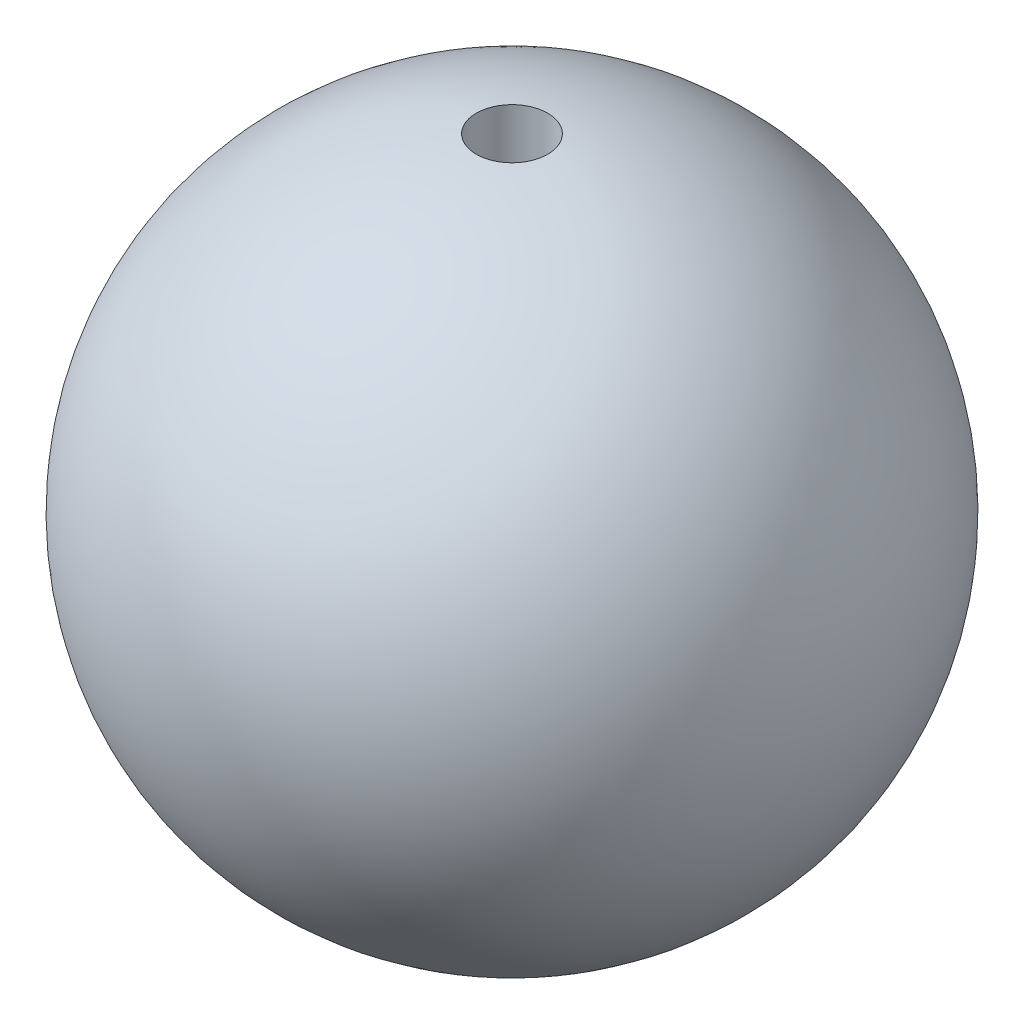
from build123d import *


with BuildPart() as part:
    # 草图1 → 旋转1 (revolve)
    with BuildSketch(Plane.XY):
        with BuildLine():
            Line((-100, 918.572806042), (-100, 149.666295471))
            ThreePointArc((-100, 149.666295471), (-170.984980078, 56.250658554), (-169.325890431, -61.063432836))
            ThreePointArc((-169.325890431, -61.063432836), (-194.123598841, -215.625132445), (-100, -340.705080757))
            Line((-100, -340.705080757), (-100, -918.572806042))
            ThreePointArc((-100, -918.572806042), (-924, 0), (-100, 918.572806042))
        make_face()
    revolve(axis=Axis((0, 0, 0), (0, 1, 0)))


solid = part.part
